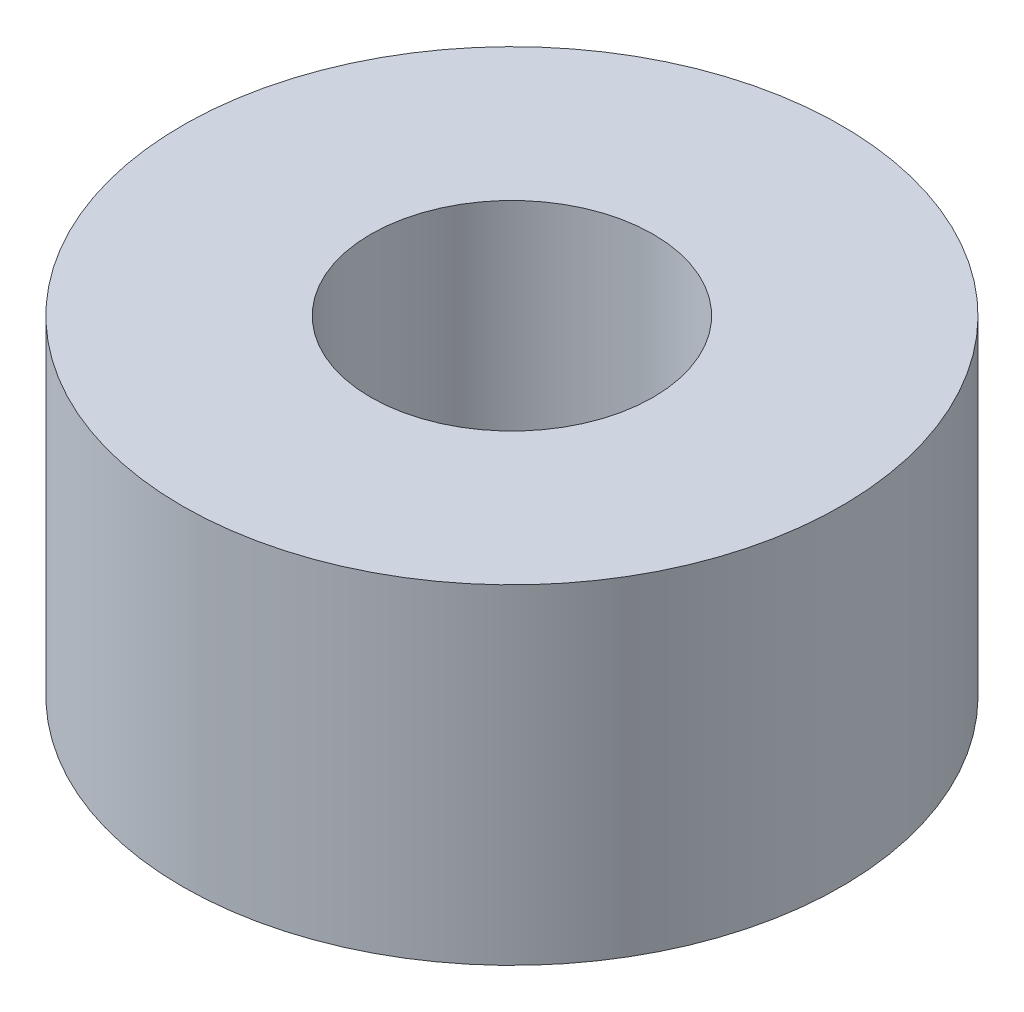
from build123d import *

# Parameters (mm, degrees)
SKETCH1_R           = 8.89
SKETCH1_R_2         = 3.81
BOSS_EXTRUDE1_DEPTH = 8.89


with BuildPart() as part:
    # Sketch1 → Boss-Extrude1 (new body)
    with BuildSketch(Plane(origin=(0, 0, 0), x_dir=(1, 0, 0), z_dir=(0, 1, 0))):
        with Locations(Location((0, 0, 0), (0, 0, 270))):
            Circle(SKETCH1_R)
        with Locations(Location((0, 0, 0), (0, 0, 270))):
            Circle(SKETCH1_R_2, mode=Mode.SUBTRACT)
    extrude(amount=BOSS_EXTRUDE1_DEPTH)


solid = part.part
